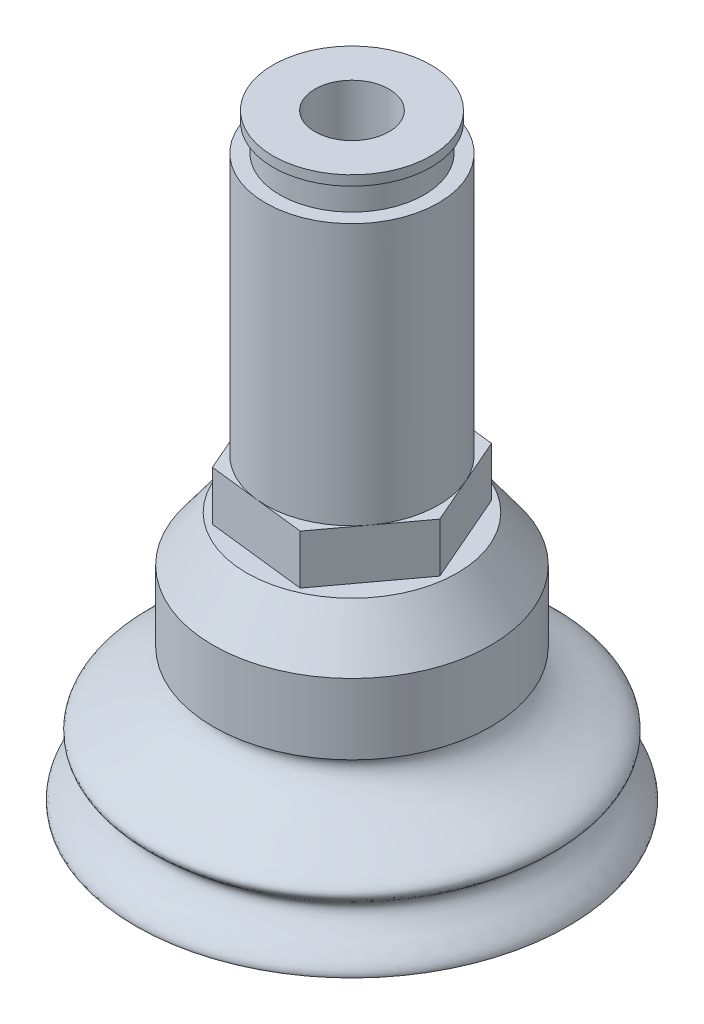
from build123d import *

# Parameters (mm, degrees)
EXTRUDE_1_DEPTH     = 4
SKETCH_3_R          = 7
EXTRUDE_2_DEPTH     = 21.2
SKETCH_4_R          = 5.851481146
EXTRUDE_3_DEPTH     = 2.2
SKETCH_5_R          = 6.392993162
EXTRUDE_4_DEPTH     = 0.8
SKETCH_6_R          = 3
CUT_EXTRUDE_1_DEPTH = 58.8


with BuildPart() as part:
    # 草图1 → 旋转1 (revolve)
    with BuildSketch(Plane.XY, mode=Mode.PRIVATE) as revolve_1_sk:
        with BuildLine():
            Line((0, -11.727997448), (-8.526388877, -11.727997448))
            Line((-8.526388877, -11.727997448), (-11.247580715, -15.435038577))
            Line((-11.247580715, -15.435038577), (-11.247580715, -21.146383116))
            add(Edge.make_bspline(
                [(-11.247580715, -21.146383116), (-9.369073773, -21.8008603), (-10.889689746, -25.079347996), (-18.519348405, -26.382423308), (-13.657626369, -29.045080289), (-17.728346259, -31.072774498), (-17.5, -32.027997448)],
                knots=[0, 0, 0, 0, 0.239282786, 0.633272554, 0.728833694, 1, 1, 1, 1], degree=3))
            Line((-17.5, -32.027997448), (-16.297611676, -32.027997448))
            Line((-16.297611676, -32.027997448), (-8.268926003, -26.138136704))
            Line((-8.268926003, -26.138136704), (-8.268926003, -20.454901012))
            Line((-8.268926003, -20.454901012), (-10.045192391, -19.845982903))
            Line((-10.045192391, -19.845982903), (-10.045192391, -16.111285163))
            Line((-10.045192391, -16.111285163), (-8.268926003, -13.47264002))
            Line((-8.268926003, -13.47264002), (0, -13.47264002))
            Line((0, -13.47264002), (0, -11.727997448))
        make_face()
    revolve(revolve_1_sk.sketch.rotate(Axis((0, 56.825270067, 0), (0, -1, 0)), 270), axis=Axis((0, 56.825270067, 0), (0, -1, 0)))

    # 草图2 → 凸台-拉伸1 (add)
    with BuildSketch(Plane(origin=(0, -11.727997448, 0), x_dir=(1, 0, 0), z_dir=(0, 1, 0))):
        Polygon((4.810541209, 6.495538978), (-3.220031161, 7.413820382), (-8.03057237, 0.918281404), (-4.810541209, -6.495538978), (3.220031161, -7.413820382), (8.03057237, -0.918281404), align=None)
    extrude(amount=EXTRUDE_1_DEPTH)

    # 草图3 → 凸台-拉伸2 (add)
    with BuildSketch(Plane(origin=(0, -7.727997448, 0), x_dir=(1, 0, 0), z_dir=(0, 1, 0))):
        with Locations(Location((0, 0, 0), (0, 0, 83.476664908))):
            Circle(SKETCH_3_R)
    extrude(amount=EXTRUDE_2_DEPTH)

    # 草图4 → 凸台-拉伸3 (add)
    with BuildSketch(Plane(origin=(0, 13.472002552, 0), x_dir=(1, 0, 0), z_dir=(0, 1, 0))):
        with Locations(Location((0, 0, 0), (0, 0, 270))):
            Circle(SKETCH_4_R)
    extrude(amount=EXTRUDE_3_DEPTH)

    # 草图5 → 凸台-拉伸4 (add)
    with BuildSketch(Plane(origin=(0, 15.672002552, 0), x_dir=(1, 0, 0), z_dir=(0, 1, 0))):
        with Locations(Location((0, 0, 0), (0, 0, 270))):
            Circle(SKETCH_5_R)
    extrude(amount=EXTRUDE_4_DEPTH)

    # 草图6 → 切除-拉伸1 (cut)
    with BuildSketch(Plane(origin=(0, 16.472002552, 0), x_dir=(1, 0, 0), z_dir=(0, 1, 0))):
        with Locations(Location((0, 0, 0), (0, 0, 270))):
            Circle(SKETCH_6_R)
    extrude(amount=-CUT_EXTRUDE_1_DEPTH, mode=Mode.SUBTRACT)


solid = part.part
